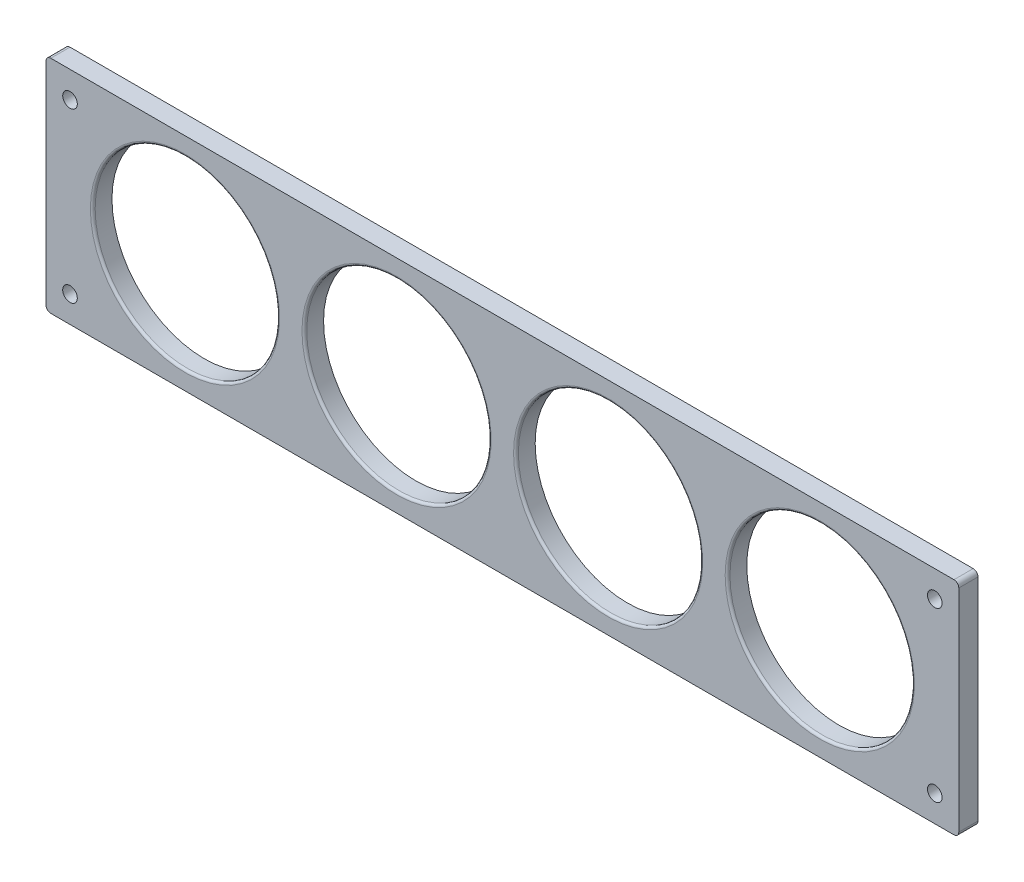
from build123d import *

# Parameters (mm, degrees)
ESQUISSE1_W             = 190
ESQUISSE1_H             = 46
ESQUISSE1_R             = 19.2
BOSS_EXTRU_1_DEPTH      = 4
ESQUISSE2_R             = 1.52
ENL_V_MAT_EXTRU_1_DEPTH = 5
CONG_2_R                = 1
CONG_3_R                = 0.5


with BuildPart() as part:
    # Esquisse1 → Boss.-Extru.1 (new body)
    with BuildSketch(Plane.XY):
        with Locations((66.068886156, 0)):
            Rectangle(ESQUISSE1_W, ESQUISSE1_H)
        Circle(ESQUISSE1_R, mode=Mode.SUBTRACT)
        with Locations((44.045924104, 0)):
            Circle(ESQUISSE1_R, mode=Mode.SUBTRACT)
        with Locations((88.091848208, 0)):
            Circle(ESQUISSE1_R, mode=Mode.SUBTRACT)
        with Locations((132.137772312, 0)):
            Circle(ESQUISSE1_R, mode=Mode.SUBTRACT)
    extrude(amount=BOSS_EXTRU_1_DEPTH)

    # Esquisse2 → Enlèv. mat.-Extru.1 (cut)
    with BuildSketch(Plane.XY.offset(4)):
        with Locations((-23.935283884, 17.499369506)):
            Circle(ESQUISSE2_R)
        with Locations(Location((-23.935283884, -17.499369506, 0), (0, 0, 180))):
            Circle(ESQUISSE2_R)
        with Locations((156.073056196, -17.499369506)):
            Circle(ESQUISSE2_R)
        with Locations(Location((156.073056196, 17.499369506, 0), (0, 0, 180))):
            Circle(ESQUISSE2_R)
    extrude(amount=-ENL_V_MAT_EXTRU_1_DEPTH, mode=Mode.SUBTRACT)

    # Congé2
    cong_2_edges = [part.edges().sort_by_distance(p)[0] for p in [
        (161.068886156, -23, 2),
        (-28.931113844, -23, 2),
        (-28.931113844, 23, 2),
        (161.068886156, 23, 2),
    ]]
    fillet(cong_2_edges, radius=CONG_2_R)

    # Congé3
    cong_3_edges = [part.edges().sort_by_distance(p)[0] for p in [
        (-19.2, 0, 4),
        (24.845924104, 0, 4),
        (68.891848208, 0, 4),
        (112.937772312, 0, 4),
    ]]
    fillet(cong_3_edges, radius=CONG_3_R)


solid = part.part
